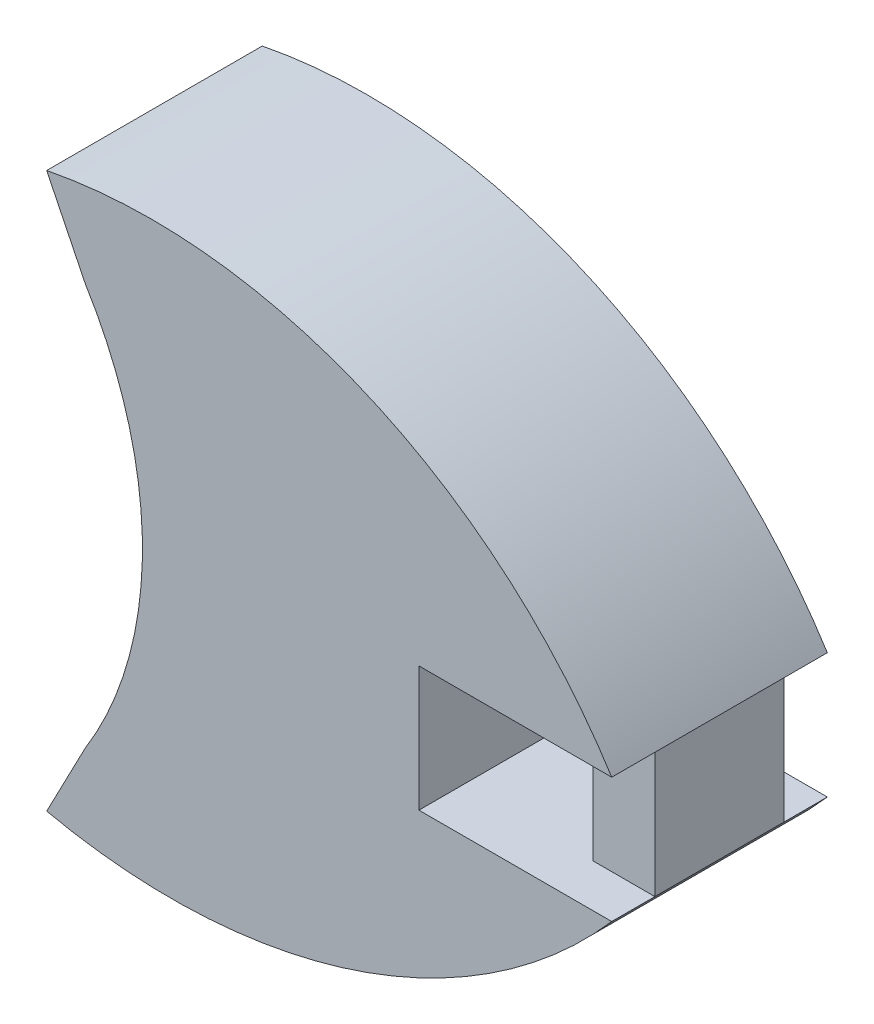
from build123d import *

# Parameters (mm, degrees)
EXTRUDE_1_DEPTH     = 10
SKETCH_2_W          = 2.859550618
SKETCH_2_H          = 5.796062829
EXTRUDE_2_DEPTH     = 10
SKETCH_11_W         = 2.859550618
SKETCH_11_H         = 5.796062829
CUT_EXTRUDE_8_DEPTH = 2
SKETCH_12_W         = 2.859550618
SKETCH_12_H         = 5.796062829
CUT_EXTRUDE_9_DEPTH = 2


with BuildPart() as part:
    # 草圖1 → 填料-伸長1 (new body)
    with BuildSketch(Plane.XY):
        with BuildLine():
            Line((0, 0), (-8.942496936, 0))
            Line((-8.942496936, 0), (-8.942496936, -5.796062829))
            Line((-8.942496936, -5.796062829), (0, -5.796062829))
            ThreePointArc((0, -5.796062829), (-11.918722494, -13.716380039), (-26.209286831, -14.469468031))
            Line((-26.209286831, -14.469468031), (-24.418965375, -11.038018573))
            ThreePointArc((-24.418965375, -11.038018573), (-21.767209123, -1.713427654), (-24.418965375, 7.611163265))
            Line((-24.418965375, 7.611163265), (-26.209286831, 11.266402905))
            ThreePointArc((-26.209286831, 11.266402905), (-11.360125695, 9.691512317), (0, 0))
        make_face()
    extrude(amount=EXTRUDE_1_DEPTH)

    # 草圖2 → 填料-伸長2 (add)
    with BuildSketch(Plane.XY):
        with Locations((-1.429775309, -2.898031415)):
            Rectangle(SKETCH_2_W, SKETCH_2_H)
    extrude(amount=EXTRUDE_2_DEPTH)

    # 草圖11 → 除料-伸長8 (cut)
    with BuildSketch(Plane.XY.offset(10)):
        with Locations((-1.429775309, -2.898031415)):
            Rectangle(SKETCH_11_W, SKETCH_11_H)
    extrude(amount=-CUT_EXTRUDE_8_DEPTH, mode=Mode.SUBTRACT)

    # 草圖12 → 除料-伸長9 (cut)
    with BuildSketch(Plane(origin=(0, 0, 0), x_dir=(-1, 0, 0), z_dir=(0, 0, -1))):
        with Locations((1.429775309, -2.898031415)):
            Rectangle(SKETCH_12_W, SKETCH_12_H)
    extrude(amount=-CUT_EXTRUDE_9_DEPTH, mode=Mode.SUBTRACT)


solid = part.part
